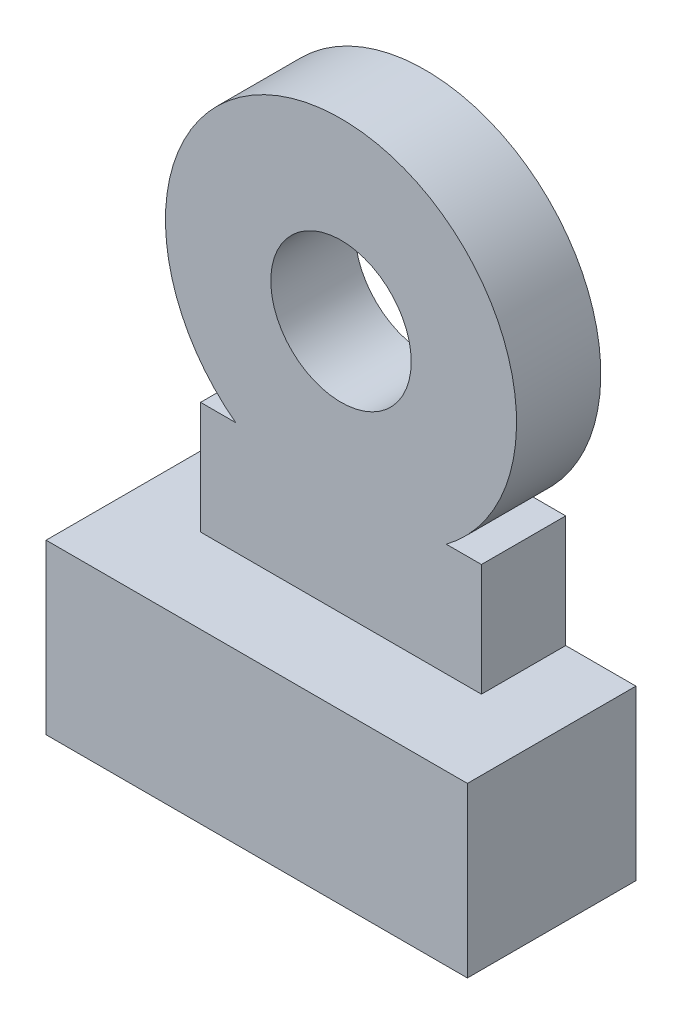
from build123d import *

# Parameters (mm, degrees)
SKETCH_1_W          = 6
SKETCH_1_H          = 2.4
EXTRUDE_1_DEPTH     = 2.4
EXTRUDE_3_DEPTH     = 1.2
SKETCH_4_R          = 1
CUT_EXTRUDE_4_DEPTH = 1.2


with BuildPart() as part:
    # 草圖1 → 伸長1 (new body)
    with BuildSketch(Plane(origin=(0, 0, 0), x_dir=(1, 0, 0), z_dir=(0, 1, 0))):
        Rectangle(SKETCH_1_W, SKETCH_1_H)
    extrude(amount=EXTRUDE_1_DEPTH)


with BuildPart() as body_2:
    # 草圖2 → 伸長3 (new body)
    with BuildSketch(Plane.XY):
        with BuildLine():
            Line((-2, 4), (-1.5, 4))
            ThreePointArc((-1.5, 4), (0, 8.5), (1.5, 4))
            Line((1.5, 4), (2, 4))
            Line((2, 4), (2, 2.4))
            Line((2, 2.4), (-2, 2.4))
            Line((-2, 2.4), (-2, 4))
        make_face()
    extrude(amount=-EXTRUDE_3_DEPTH)

    # 草圖4 → 伸長4 (cut)
    with BuildSketch(Plane.XY):
        with Locations((0, 6)):
            Circle(SKETCH_4_R)
    extrude(amount=-CUT_EXTRUDE_4_DEPTH, mode=Mode.SUBTRACT)


solid = Compound([part.part, body_2.part])
